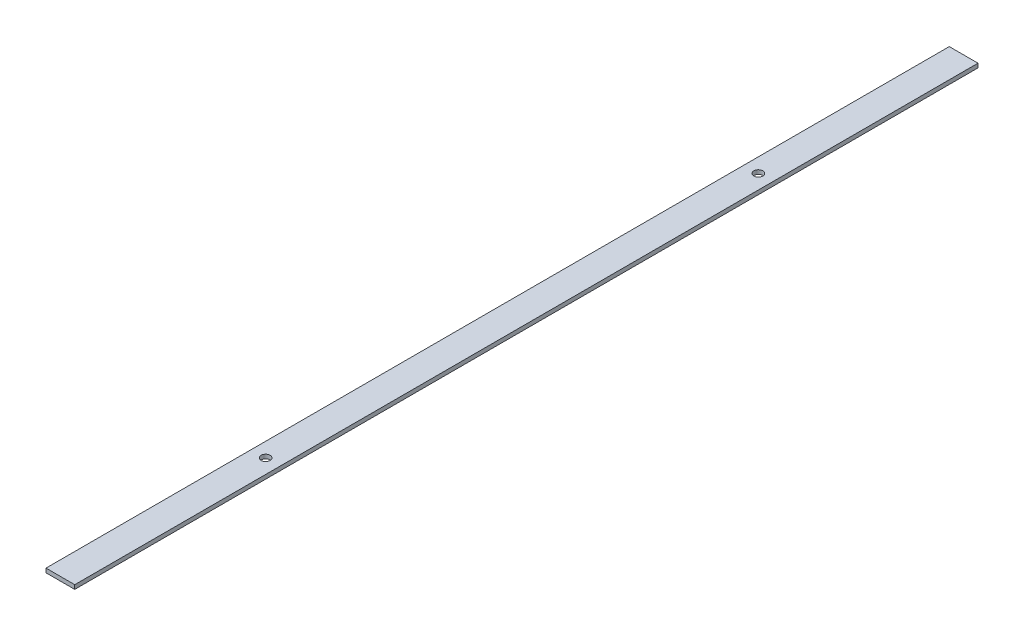
from build123d import *

# Parameters (mm, degrees)
SKETCH_1_W          = 70
SKETCH_1_H          = 10
EXTRUDE_1_DEPTH     = 2200
SKETCH_2_R          = 11
CUT_EXTRUDE_1_DEPTH = 2202.136070306


with BuildPart() as part:
    # 草图1 → 凸台-拉伸1 (new body)
    with BuildSketch(Plane.XY):
        with Locations((35, 5)):
            Rectangle(SKETCH_1_W, SKETCH_1_H)
    extrude(amount=-EXTRUDE_1_DEPTH)

    # 草图2 → 切除-拉伸1 (cut, through all)
    with BuildSketch(Plane(origin=(0, 10, 0), x_dir=(1, 0, 0), z_dir=(0, 1, 0))):
        with Locations(Location((35, 1700, 0), (0, 0, 270))):
            Circle(SKETCH_2_R)
        with Locations(Location((35, 500, 0), (0, 0, 270))):
            Circle(SKETCH_2_R)
    extrude(amount=-CUT_EXTRUDE_1_DEPTH, mode=Mode.SUBTRACT)


solid = part.part
